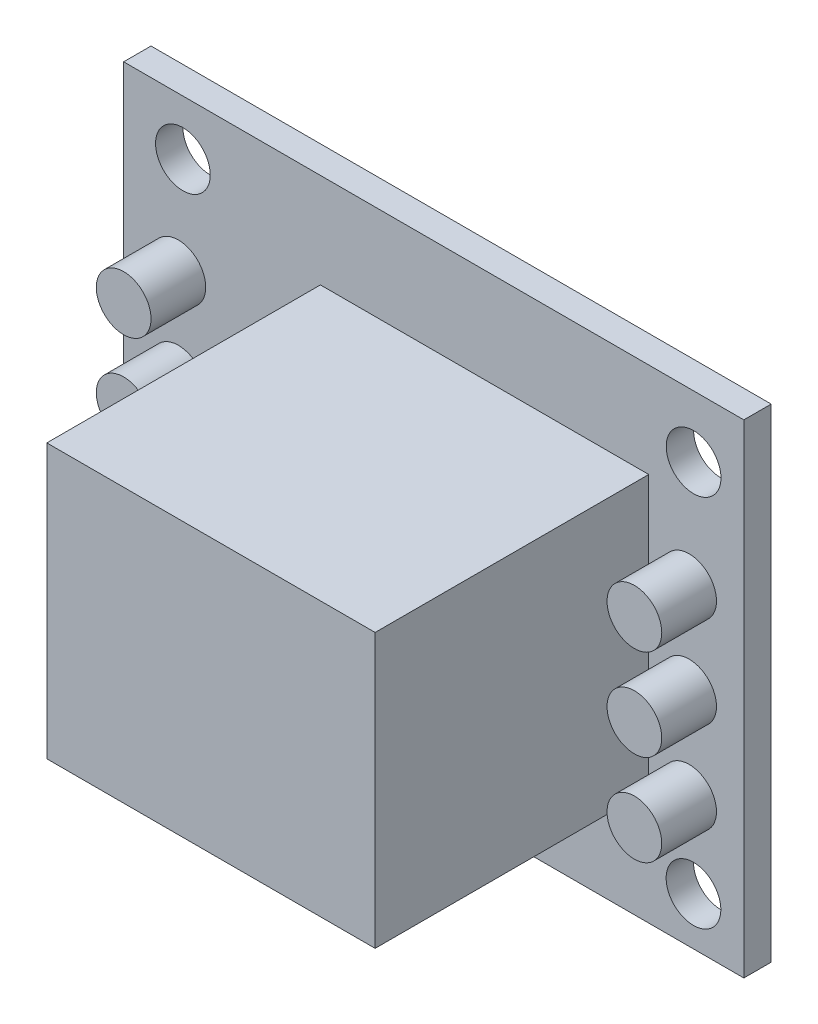
from build123d import *

# Parameters (mm, degrees)
SKETCH_1_W      = 34
SKETCH_1_H      = 26.5
SKETCH_1_R      = 1.5
EXTRUDE_1_DEPTH = 1.5
SKETCH_2_W      = 18
SKETCH_2_H      = 15
EXTRUDE_2_DEPTH = 15
SKETCH_3_R      = 1.5
EXTRUDE_3_DEPTH = 3


with BuildPart() as part:
    # 草圖1 → 填料-伸長1 (new body)
    with BuildSketch(Plane.XY):
        with Locations((2.280137649, 0.208767123)):
            Rectangle(SKETCH_1_W, SKETCH_1_H)
        with Locations((-11.47221535, 10.458766514)):
            Circle(SKETCH_1_R, mode=Mode.SUBTRACT)
        with Locations((-11.47721535, -10.041232877)):
            Circle(SKETCH_1_R, mode=Mode.SUBTRACT)
        with Locations((16.520137649, -10.426232877)):
            Circle(SKETCH_1_R, mode=Mode.SUBTRACT)
        with Locations((16.525137649, 10.073766514)):
            Circle(SKETCH_1_R, mode=Mode.SUBTRACT)
    extrude(amount=EXTRUDE_1_DEPTH)

    # 草圖2 → 填料-伸長2 (add)
    with BuildSketch(Plane.XY.offset(1.5)):
        with Locations((5.066714054, 0.758767123)):
            Rectangle(SKETCH_2_W, SKETCH_2_H)
    extrude(amount=EXTRUDE_2_DEPTH)

    # 草圖3 → 填料-伸長3 (add)
    with BuildSketch(Plane.XY.offset(1.5)):
        with Locations((-11.719862351, 5)):
            Circle(SKETCH_3_R)
        with Locations((-11.719862351, 0)):
            Circle(SKETCH_3_R)
        with Locations((-11.719862351, -5)):
            Circle(SKETCH_3_R)
        with Locations((16.280137649, 4.100671386)):
            Circle(SKETCH_3_R)
        with Locations((16.280137649, -0.899328614)):
            Circle(SKETCH_3_R)
        with Locations((16.280137649, -5.899328614)):
            Circle(SKETCH_3_R)
    extrude(amount=EXTRUDE_3_DEPTH)


solid = part.part
